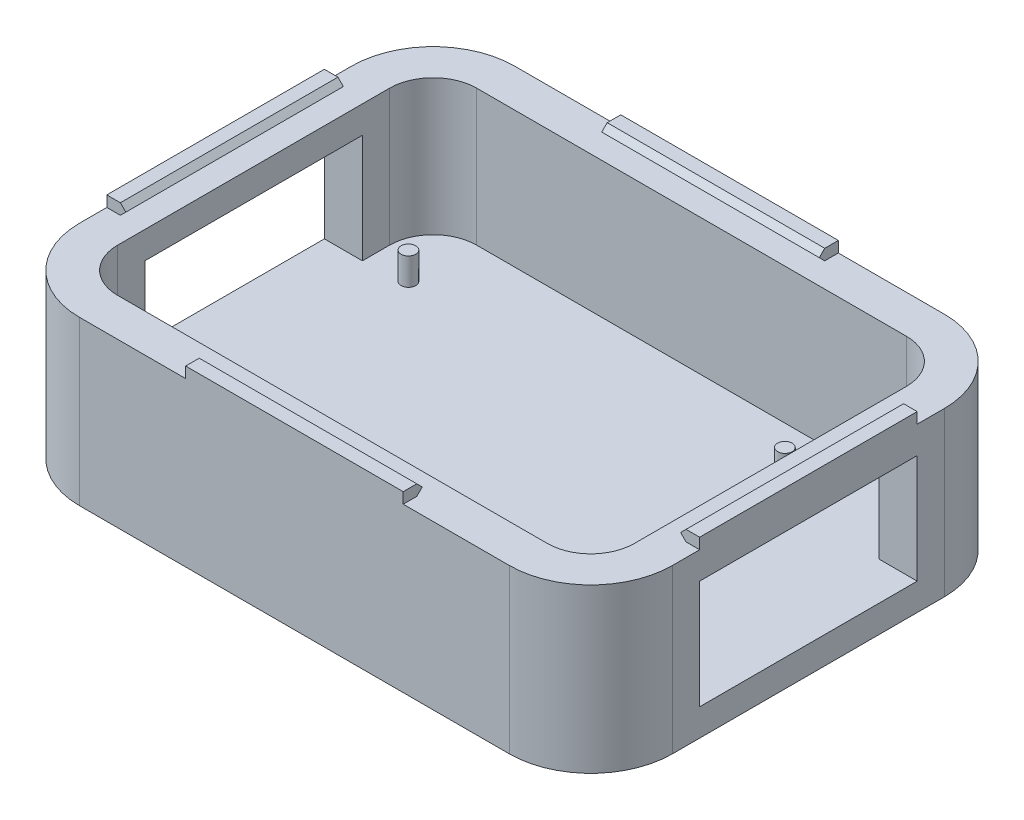
from build123d import *

# Parameters (mm, degrees)
BOSS_EXTRUDE1_DEPTH     = 5
SKETCH4_R               = 3.1
CUT_EXTRUDE1_DEPTH      = 4
BOSS_EXTRUDE3_DEPTH     = 30
CUT_EXTRUDE2_DEPTH      = 120.920807202
CUT_EXTRUDE2_DEPTH_BACK = 120.920807202
SKETCH7_W               = 40
SKETCH7_H               = 20
BOSS_EXTRUDE2_START     = 5
SKETCH3_R               = 1.35
BOSS_EXTRUDE2_DEPTH     = 5
BOSS_EXTRUDE6_DEPTH     = 20
BOSS_EXTRUDE7_DEPTH     = 20


with BuildPart() as part:
    # Sketch1 → Boss-Extrude1 (new body)
    with BuildSketch(Plane(origin=(0, 0, 0), x_dir=(1, 0, 0), z_dir=(0, 1, 0))):
        with BuildLine():
            Line((-39.5, 40), (39.5, 40))
            ThreePointArc((39.5, 40), (50.106601718, 35.606601718), (54.5, 25))
            Line((54.5, 25), (54.5, -25))
            ThreePointArc((54.5, -25), (50.106601718, -35.606601718), (39.5, -40))
            Line((39.5, -40), (-39.5, -40))
            ThreePointArc((-39.5, -40), (-50.106601718, -35.606601718), (-54.5, -25))
            Line((-54.5, -25), (-54.5, 25))
            ThreePointArc((-54.5, 25), (-50.106601718, 35.606601718), (-39.5, 40))
        make_face()
    extrude(amount=BOSS_EXTRUDE1_DEPTH)

    # Sketch4 → Cut-Extrude1 (cut)
    with BuildSketch(Plane(origin=(0, 0, 0), x_dir=(1, 0, 0), z_dir=(0, 1, 0))):
        with Locations(Location((-40, -28.424678982, 0), (0, 0, 270))):
            Circle(SKETCH4_R)
        with Locations(Location((40, -28.424678982, 0), (0, 0, 270))):
            Circle(SKETCH4_R)
        with Locations(Location((40, 28.424678982, 0), (0, 0, 270))):
            Circle(SKETCH4_R)
        with Locations(Location((-40, 28.424678982, 0), (0, 0, 270))):
            Circle(SKETCH4_R)
        with Locations(Location((-17.5, 0, 0), (0, 0, 270))):
            Circle(SKETCH4_R)
        with Locations(Location((0, -17.5, 0), (0, 0, 270))):
            Circle(SKETCH4_R)
        with Locations(Location((17.5, 0, 0), (0, 0, 270))):
            Circle(SKETCH4_R)
        with Locations(Location((0, 17.5, 0), (0, 0, 270))):
            Circle(SKETCH4_R)
        with Locations(Location((-17.5, 17.5, 0), (0, 0, 270))):
            Circle(SKETCH4_R)
        with Locations(Location((17.5, 17.5, 0), (0, 0, 270))):
            Circle(SKETCH4_R)
        with Locations(Location((17.5, -17.5, 0), (0, 0, 270))):
            Circle(SKETCH4_R)
        with Locations(Location((-17.5, -17.5, 0), (0, 0, 270))):
            Circle(SKETCH4_R)
        with Locations(Location((0, 0, 0), (0, 0, 270))):
            Circle(SKETCH4_R)
    extrude(amount=CUT_EXTRUDE1_DEPTH, mode=Mode.SUBTRACT)

    # Sketch1<3> → Boss-Extrude3 (add)
    with BuildSketch(Plane(origin=(0, 0, 0), x_dir=(1, 0, 0), z_dir=(0, 1, 0))):
        with BuildLine():
            Line((-39.5, 40), (39.5, 40))
            ThreePointArc((39.5, 40), (50.106601718, 35.606601718), (54.5, 25))
            Line((54.5, 25), (54.5, -25))
            ThreePointArc((54.5, -25), (50.106601718, -35.606601718), (39.5, -40))
            Line((39.5, -40), (-39.5, -40))
            ThreePointArc((-39.5, -40), (-50.106601718, -35.606601718), (-54.5, -25))
            Line((-54.5, -25), (-54.5, 25))
            ThreePointArc((-54.5, 25), (-50.106601718, 35.606601718), (-39.5, 40))
        make_face()
        with BuildLine():
            ThreePointArc((-39.5, 33), (-45.156854249, 30.656854249), (-47.5, 25))
            Line((-47.5, 25), (-47.5, -25))
            ThreePointArc((-47.5, -25), (-45.156854249, -30.656854249), (-39.5, -33))
            Line((-39.5, -33), (39.5, -33))
            ThreePointArc((39.5, -33), (45.156854249, -30.656854249), (47.5, -25))
            Line((47.5, -25), (47.5, 25))
            ThreePointArc((47.5, 25), (45.156854249, 30.656854249), (39.5, 33))
            Line((39.5, 33), (-39.5, 33))
        make_face(mode=Mode.SUBTRACT)
    extrude(amount=BOSS_EXTRUDE3_DEPTH)

    # Sketch7 → Cut-Extrude2 (cut, two sides: drawn at the far end of the back side and taken through both)
    with BuildSketch(Plane.ZY.offset(54.5).offset(-CUT_EXTRUDE2_DEPTH_BACK)):
        with Locations((0, 15)):
            Rectangle(SKETCH7_W, SKETCH7_H)
    extrude(amount=CUT_EXTRUDE2_DEPTH + CUT_EXTRUDE2_DEPTH_BACK, mode=Mode.SUBTRACT)

    # Sketch3 → Boss-Extrude2 (add)
    with BuildSketch(Plane(origin=(0, 0, 0), x_dir=(1, 0, 0), z_dir=(0, 1, 0)).offset(BOSS_EXTRUDE2_START)):
        with Locations(Location((26.04, 24.13, 0), (0, 0, 270))):
            Circle(SKETCH3_R)
        with Locations(Location((-40, 20.955, 0), (0, 0, 270))):
            Circle(SKETCH3_R)
        with Locations(Location((-40, -20.955, 0), (0, 0, 270))):
            Circle(SKETCH3_R)
        with Locations(Location((26.04, -24.13, 0), (0, 0, 270))):
            Circle(SKETCH3_R)
    extrude(amount=BOSS_EXTRUDE2_DEPTH)

    # Sketch10 → Boss-Extrude6 (add, symmetric)
    with BuildSketch(Plane(origin=(0, 0, 0), x_dir=(0, 0, -1), z_dir=(1, 0, 0))):
        Polygon((37.5, 30), (40, 30), (40, 32), (37.5, 32), (36.5, 31), align=None)
    boss_extrude6 = extrude(amount=BOSS_EXTRUDE6_DEPTH, both=True)

    # Mirror2: Boss-Extrude6 across plane
    add(boss_extrude6.mirror(Plane.XY))

    # Sketch12 → Boss-Extrude7 (add, symmetric)
    with BuildSketch(Plane.XY):
        Polygon((52, 30), (54.5, 30), (54.5, 32), (52, 32), (51, 31), align=None)
    boss_extrude7 = extrude(amount=BOSS_EXTRUDE7_DEPTH, both=True)

    # Mirror3: Boss-Extrude7 across plane
    add(boss_extrude7.mirror(Plane(origin=(0, 0, 0), x_dir=(0, 0, 1), z_dir=(1, 0, 0))))


solid = part.part
